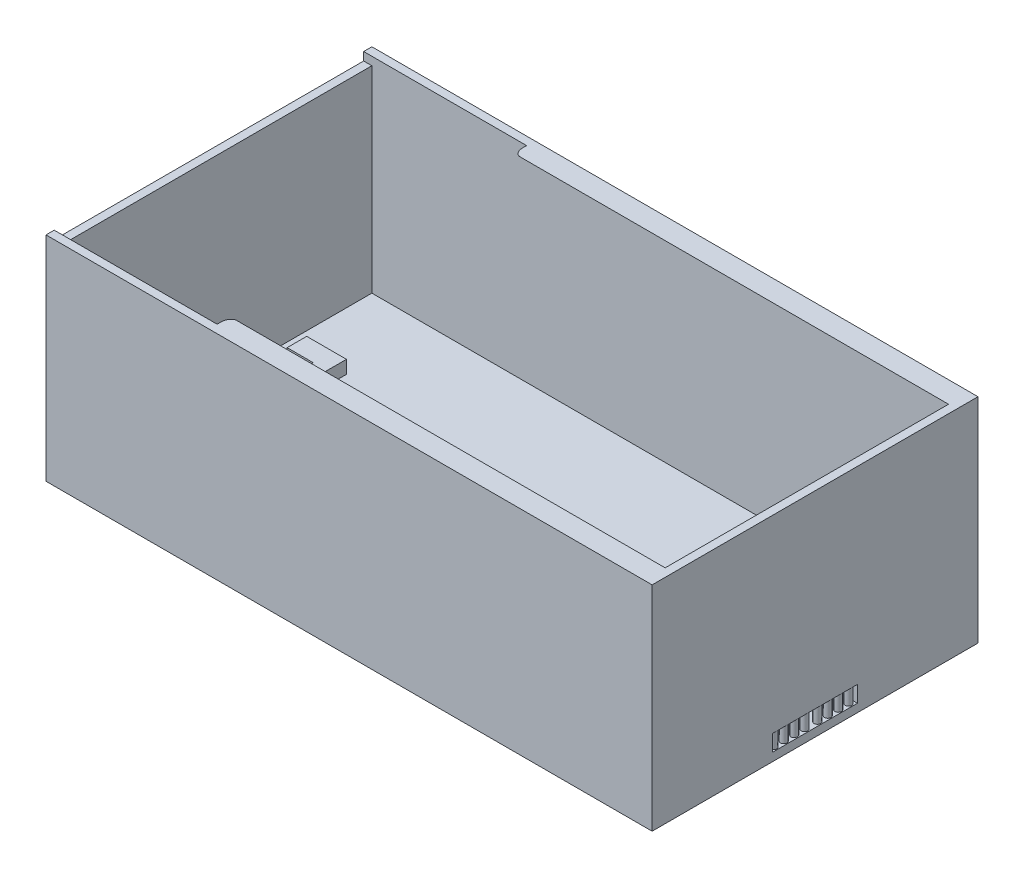
from build123d import *

# Parameters (mm, degrees)
ESBO_O1_W                = 93
ESBO_O1_H                = 50
RESSALTO_EXTRUS_O1_DEPTH = 1.26
ESBO_O2_W                = 93
ESBO_O2_H                = 1.26
RESSALTO_EXTRUS_O2_DEPTH = 32.74
ESBO_O3_W                = 1.26
ESBO_O3_H                = 50
RESSALTO_EXTRUS_O4_DEPTH = 32.74
RESSALTO_EXTRUS_O5_START = 25
RESSALTO_EXTRUS_O5_DEPTH = 67
FILETE1_R                = 1
FILETE2_R                = 1
ESBO_O6_W                = 1.26
ESBO_O6_H                = 50
RESSALTO_EXTRUS_O6_DEPTH = 31.48
ESBO_O7_W                = 11
ESBO_O7_H                = 2.5
CORTE_EXTRUS_O1_DEPTH    = 1.26
ESBO_O8_W                = 13
ESBO_O8_H                = 2.5
CORTE_EXTRUS_O2_DEPTH    = 1.26
RESSALTO_EXTRUS_O7_DEPTH = 2
RESSALTO_EXTRUS_O8_DEPTH = 2
ESBO_O13_R               = 0.5
RESSALTO_EXTRUS_O9_DEPTH = 4


with BuildPart() as part:
    # Esboço1 → Ressalto-extrusão1 (new body)
    with BuildSketch(Plane(origin=(0, 0, 0), x_dir=(1, 0, 0), z_dir=(0, 1, 0))):
        with Locations((46.5, -25)):
            Rectangle(ESBO_O1_W, ESBO_O1_H)
    extrude(amount=RESSALTO_EXTRUS_O1_DEPTH)

    # Esboço2 → Ressalto-extrusão2 (add)
    with BuildSketch(Plane(origin=(0, 0, 0), x_dir=(1, 0, 0), z_dir=(0, 1, 0))):
        with Locations((46.5, -0.63)):
            Rectangle(ESBO_O2_W, ESBO_O2_H)
        with Locations((46.5, -49.37)):
            Rectangle(ESBO_O2_W, ESBO_O2_H)
    extrude(amount=RESSALTO_EXTRUS_O2_DEPTH)

    # Esboço3 → Ressalto-extrusão4 (add)
    with BuildSketch(Plane(origin=(0, 0, 0), x_dir=(1, 0, 0), z_dir=(0, 1, 0))):
        with Locations((92.37, -25)):
            Rectangle(ESBO_O3_W, ESBO_O3_H)
    extrude(amount=RESSALTO_EXTRUS_O4_DEPTH)

    # Esboço5 → Ressalto-extrusão5 (add)
    with BuildSketch(Plane(origin=(0, 0, 0), x_dir=(0, 0, -1), z_dir=(1, 0, 0)).offset(RESSALTO_EXTRUS_O5_START)):
        Polygon((0, 32.74), (-3.26, 32.74), (0, 29.48), align=None)
        Polygon((-50, 32.74), (-46.74, 32.74), (-50, 29.48), align=None)
    extrude(amount=RESSALTO_EXTRUS_O5_DEPTH)

    # Filete1
    filete1_edges = [part.edges().sort_by_distance(p)[0] for p in [
        (25, 31.74, 47.74),
    ]]
    fillet(filete1_edges, radius=FILETE1_R)

    # Filete2
    filete2_edges = [part.edges().sort_by_distance(p)[0] for p in [
        (25, 31.74, 2.26),
    ]]
    fillet(filete2_edges, radius=FILETE2_R)

    # Esboço6 → Ressalto-extrusão6 (add)
    with BuildSketch(Plane(origin=(0, 0, 0), x_dir=(1, 0, 0), z_dir=(0, 1, 0))):
        with Locations((0.63, -25)):
            Rectangle(ESBO_O6_W, ESBO_O6_H)
    extrude(amount=RESSALTO_EXTRUS_O6_DEPTH)

    # Esboço7 → Corte-extrusão1 (cut)
    with BuildSketch(Plane.ZY):
        with Locations((25, 2.51)):
            Rectangle(ESBO_O7_W, ESBO_O7_H)
    extrude(amount=-CORTE_EXTRUS_O1_DEPTH, mode=Mode.SUBTRACT)

    # Esboço8 → Corte-extrusão2 (cut)
    with BuildSketch(Plane(origin=(93, 0, 0), x_dir=(0, 0, -1), z_dir=(1, 0, 0))):
        with Locations((-25, 2.51)):
            Rectangle(ESBO_O8_W, ESBO_O8_H)
    extrude(amount=-CORTE_EXTRUS_O2_DEPTH, mode=Mode.SUBTRACT)

    # Esboço10 → Ressalto-extrusão7 (add)
    with BuildSketch(Plane(origin=(0, 1.26, 0), x_dir=(1, 0, 0), z_dir=(0, 1, 0))):
        Polygon((4, -14), (4, -17), (8, -17), (8, -19), (10.1, -19), (10.1, -14), align=None)
        Polygon((4, -33), (4, -36), (10.1, -36), (10.1, -31), (8, -31), (8, -33), align=None)
    extrude(amount=RESSALTO_EXTRUS_O7_DEPTH)

    # Esboço11 → Ressalto-extrusão8 (add)
    with BuildSketch(Plane(origin=(0, 1.26, 0), x_dir=(1, 0, 0), z_dir=(0, 1, 0))):
        Polygon((87.74, -12.74), (82.9, -12.74), (82.9, -18), (85, -18), (85, -16), (87.74, -16), align=None)
        Polygon((87.74, -34), (87.74, -37.26), (82.9, -37.26), (82.9, -32), (85, -32), (85, -34), align=None)
    extrude(amount=RESSALTO_EXTRUS_O8_DEPTH)

    # Esboço13 → Ressalto-extrusão9 (add)
    with BuildSketch(Plane.XZ):
        with Locations(Location((92.37, 30.775, 0), (0, 0, 90))):
            Circle(ESBO_O13_R)
        with Locations(Location((92.37, 29.175, 0), (0, 0, 90))):
            Circle(ESBO_O13_R)
        with Locations(Location((92.37, 27.575, 0), (0, 0, 90))):
            Circle(ESBO_O13_R)
        with Locations(Location((92.37, 25.975, 0), (0, 0, 90))):
            Circle(ESBO_O13_R)
        with Locations(Location((92.37, 24.025, 0), (0, 0, 90))):
            Circle(ESBO_O13_R)
        with Locations(Location((92.37, 22.425, 0), (0, 0, 90))):
            Circle(ESBO_O13_R)
        with Locations(Location((92.37, 20.825, 0), (0, 0, 90))):
            Circle(ESBO_O13_R)
        with Locations(Location((92.37, 19.225, 0), (0, 0, 90))):
            Circle(ESBO_O13_R)
        with Locations((0.63, 19.225)):
            Circle(ESBO_O13_R)
        with Locations(Location((0.63, 20.825, 0), (0, 0, 90))):
            Circle(ESBO_O13_R)
        with Locations(Location((0.63, 22.425, 0), (0, 0, 90))):
            Circle(ESBO_O13_R)
        with Locations(Location((0.63, 24.025, 0), (0, 0, 90))):
            Circle(ESBO_O13_R)
        with Locations(Location((0.63, 25.975, 0), (0, 0, 90))):
            Circle(ESBO_O13_R)
        with Locations(Location((0.63, 27.575, 0), (0, 0, 90))):
            Circle(ESBO_O13_R)
        with Locations(Location((0.63, 29.175, 0), (0, 0, 90))):
            Circle(ESBO_O13_R)
        with Locations((0.63, 30.775)):
            Circle(ESBO_O13_R)
    extrude(amount=-RESSALTO_EXTRUS_O9_DEPTH)


solid = part.part
